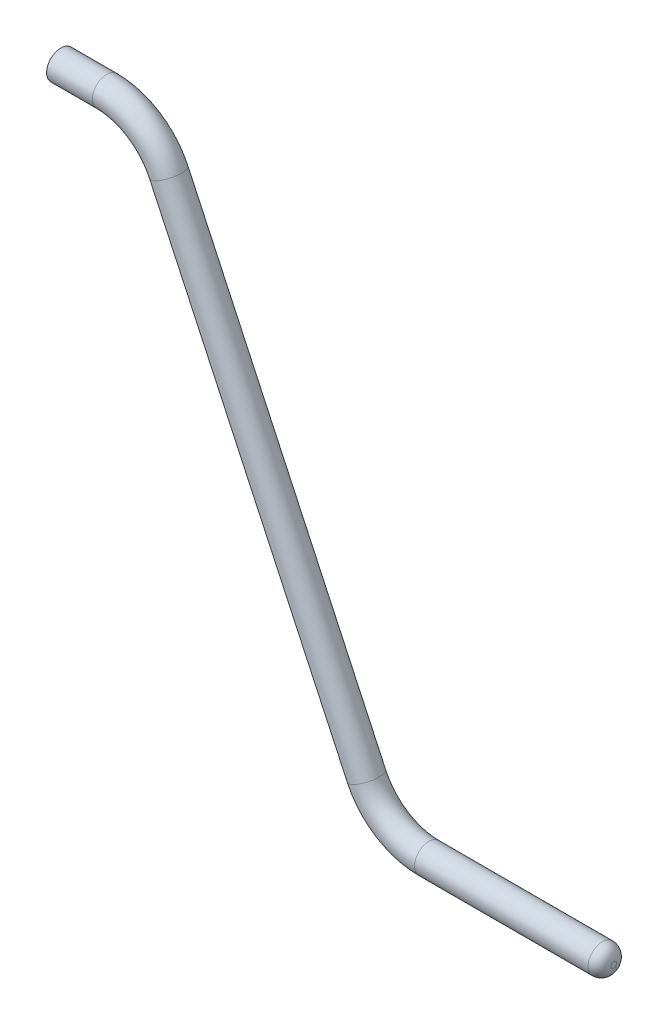
from build123d import *

# Parameters (mm, degrees)
SKETCH2_R = 0.625
FILLET2_R = 0.5


with BuildPart() as part:
    # Sweep1: sweep along a path in Sketch1
    with BuildLine(Plane.XY) as sweep1_path:
        Line((0, 0), (-8.088789218, 0))
        ThreePointArc((-8.088789218, 0), (-9.700688043, 0.469825663), (-10.807712579, 1.732145215))
        Line((-10.807712579, 1.732145215), (-19.451055901, 20.267854785))
        ThreePointArc((-19.451055901, 20.267854785), (-20.558080437, 21.530174337), (-22.169979262, 22))
        Line((-22.169979262, 22), (-24.169979262, 22))
    # Sketch2 → Sweep1 (sweep)
    with BuildSketch(Plane(origin=(0, 0, 0), x_dir=(0, 0, -1), z_dir=(1, 0, 0))):
        Circle(SKETCH2_R)
    sweep(path=sweep1_path.line)

    # Fillet2
    fillet2_edges = [part.edges().sort_by_distance(p)[0] for p in [
        (0, 0, 0.625),
    ]]
    fillet(fillet2_edges, radius=FILLET2_R)


solid = part.part
